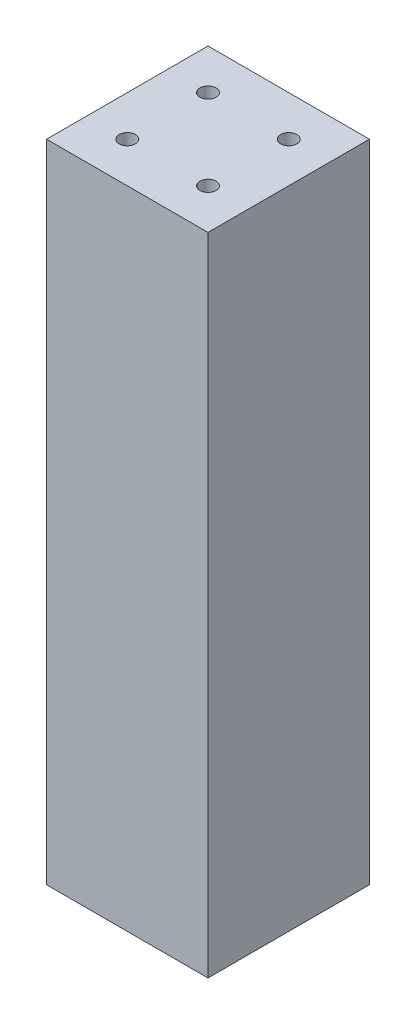
from build123d import *

# Parameters (mm, degrees)
SKETCH1_W                   = 50.8
SKETCH1_H                   = 50.8
BOSS_EXTRUDE1_DEPTH         = 203.2
F_1_4_20_TAPPED_HOLE1_D     = 5.1054
F_1_4_20_TAPPED_HOLE1_DEPTH = 16.51
F_1_4_20_TAPPED_HOLE1_TIP   = 1.533816902
F_1_4_20_TAPPED_HOLE2_D     = 5.1054
F_1_4_20_TAPPED_HOLE2_DEPTH = 16.51
F_1_4_20_TAPPED_HOLE2_TIP   = 1.533816902


with BuildPart() as part:
    # Sketch1 → Boss-Extrude1 (new body)
    with BuildSketch(Plane(origin=(0, 0, 0), x_dir=(1, 0, 0), z_dir=(0, 1, 0))):
        Rectangle(SKETCH1_W, SKETCH1_H)
    extrude(amount=BOSS_EXTRUDE1_DEPTH)

    # 1/4-20 Tapped Hole1
    with Locations(Plane(origin=(0, 203.2, 0), x_dir=(1, 0, 0), z_dir=(0, 1, 0))):
        with Locations((-12.7, 12.7), (12.7, 12.7), (12.7, -12.7), (-12.7, -12.7)):
            Hole(F_1_4_20_TAPPED_HOLE1_D / 2, depth=F_1_4_20_TAPPED_HOLE1_DEPTH)
            with Locations((0, 0, -(F_1_4_20_TAPPED_HOLE1_DEPTH + F_1_4_20_TAPPED_HOLE1_TIP / 2))):  # 118° drill point
                Cone(0, F_1_4_20_TAPPED_HOLE1_D / 2, F_1_4_20_TAPPED_HOLE1_TIP, mode=Mode.SUBTRACT)

    # 1/4-20 Tapped Hole2
    with Locations(Plane(origin=(0, 0, 0), x_dir=(-1, 0, 0), z_dir=(0, -1, 0))):
        with Locations((-12.7, 12.7), (12.7, 12.7), (12.7, -12.7), (-12.7, -12.7)):
            Hole(F_1_4_20_TAPPED_HOLE2_D / 2, depth=F_1_4_20_TAPPED_HOLE2_DEPTH)
            with Locations((0, 0, -(F_1_4_20_TAPPED_HOLE2_DEPTH + F_1_4_20_TAPPED_HOLE2_TIP / 2))):  # 118° drill point
                Cone(0, F_1_4_20_TAPPED_HOLE2_D / 2, F_1_4_20_TAPPED_HOLE2_TIP, mode=Mode.SUBTRACT)


solid = part.part
